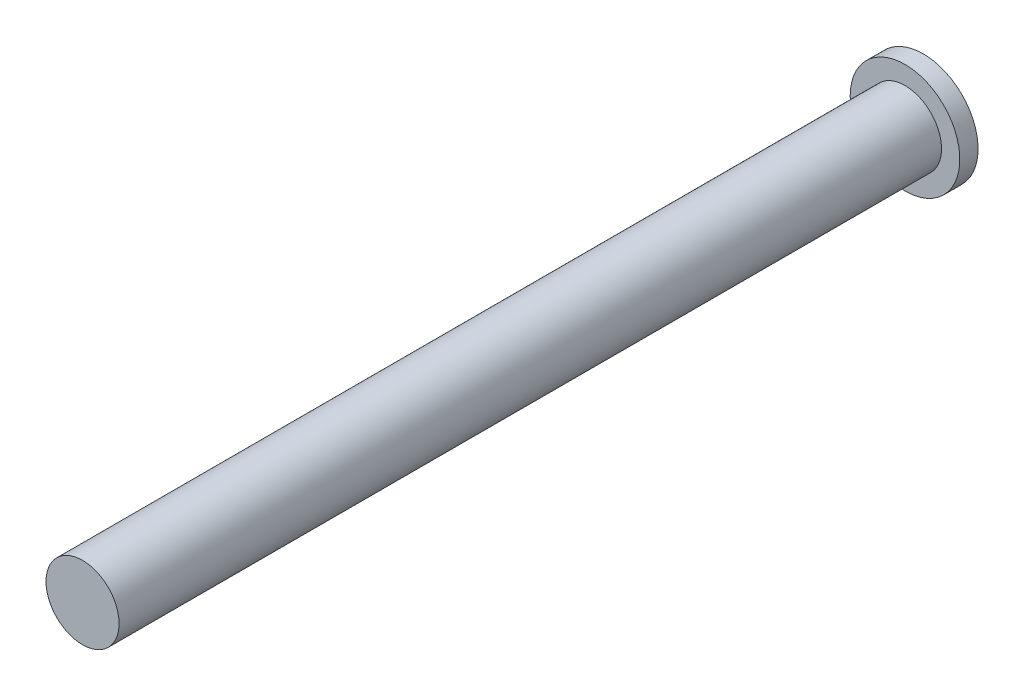
from build123d import *

# Parameters (mm, degrees)
SKETCH_1_R      = 2
EXTRUDE_1_DEPTH = 45
SKETCH_2_R      = 3
EXTRUDE_2_DEPTH = 1


with BuildPart() as part:
    # 草图1 → 凸台-拉伸1 (new body)
    with BuildSketch(Plane.XY):
        with Locations(Location((0, 0, 0), (0, 0, 180))):
            Circle(SKETCH_1_R)
    extrude(amount=EXTRUDE_1_DEPTH)

    # 草图2 → 凸台-拉伸2 (add)
    with BuildSketch(Plane(origin=(0, 0, 0), x_dir=(-1, 0, 0), z_dir=(0, 0, -1))):
        Circle(SKETCH_2_R)
    extrude(amount=EXTRUDE_2_DEPTH)


solid = part.part
